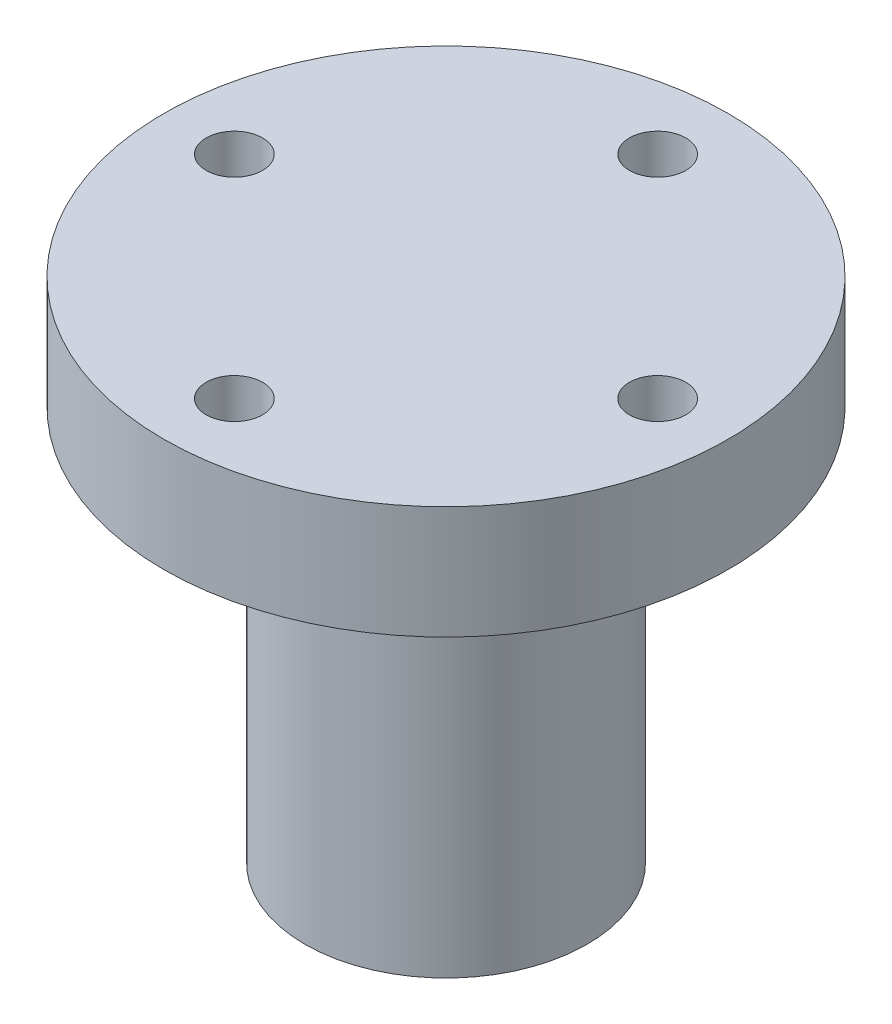
from build123d import *

# Parameters (mm, degrees)
CROQUIS1_R              = 25
SALIENTE_EXTRUIR1_DEPTH = 35
CROQUIS2_R              = 50
SALIENTE_EXTRUIR2_DEPTH = 20
CORTAR_EXTRUIR1_REACH   = 116.455
CROQUIS3_R              = 5


with BuildPart() as part:
    # Croquis1 → Saliente-Extruir1 (new, symmetric)
    with BuildSketch(Plane(origin=(0, 0, 0), x_dir=(1, 0, 0), z_dir=(0, 1, 0))):
        with Locations(Location((0, 0, 0), (0, 0, 270))):
            Circle(CROQUIS1_R)
    extrude(amount=SALIENTE_EXTRUIR1_DEPTH, both=True)

    # Croquis2 → Saliente-Extruir2 (add)
    with BuildSketch(Plane(origin=(0, 35, 0), x_dir=(1, 0, 0), z_dir=(0, 1, 0))):
        with Locations(Location((0, 0, 0), (0, 0, 270))):
            Circle(CROQUIS2_R)
    extrude(amount=SALIENTE_EXTRUIR2_DEPTH)

    # Croquis3 → Cortar-Extruir1 (cut, up to next)
    with BuildSketch(Plane(origin=(0, 55, 0), x_dir=(1, 0, 0), z_dir=(0, 1, 0)), mode=Mode.PRIVATE) as cortar_extruir1_sk1:
        with Locations(Location((0, 37.5, 0), (0, 0, 270))):
            Circle(CROQUIS3_R)
    cortar_extruir1_tool1 = extrude(cortar_extruir1_sk1.sketch, amount=-CORTAR_EXTRUIR1_REACH, mode=Mode.PRIVATE) & part.part
    # Croquis3 → Cortar-Extruir1 (cut, up to next)
    with BuildSketch(Plane(origin=(0, 55, 0), x_dir=(1, 0, 0), z_dir=(0, 1, 0)), mode=Mode.PRIVATE) as cortar_extruir1_sk2:
        with Locations(Location((37.5, 0, 0), (0, 0, 270))):
            Circle(CROQUIS3_R)
    cortar_extruir1_tool2 = extrude(cortar_extruir1_sk2.sketch, amount=-CORTAR_EXTRUIR1_REACH, mode=Mode.PRIVATE) & part.part
    # Croquis3 → Cortar-Extruir1 (cut, up to next)
    with BuildSketch(Plane(origin=(0, 55, 0), x_dir=(1, 0, 0), z_dir=(0, 1, 0)), mode=Mode.PRIVATE) as cortar_extruir1_sk3:
        with Locations(Location((0, -37.5, 0), (0, 0, 270))):
            Circle(CROQUIS3_R)
    cortar_extruir1_tool3 = extrude(cortar_extruir1_sk3.sketch, amount=-CORTAR_EXTRUIR1_REACH, mode=Mode.PRIVATE) & part.part
    # Croquis3 → Cortar-Extruir1 (cut, up to next)
    with BuildSketch(Plane(origin=(0, 55, 0), x_dir=(1, 0, 0), z_dir=(0, 1, 0)), mode=Mode.PRIVATE) as cortar_extruir1_sk4:
        with Locations(Location((-37.5, 0, 0), (0, 0, 270))):
            Circle(CROQUIS3_R)
    cortar_extruir1_tool4 = extrude(cortar_extruir1_sk4.sketch, amount=-CORTAR_EXTRUIR1_REACH, mode=Mode.PRIVATE) & part.part
    add(cortar_extruir1_tool1.solids().sort_by_distance((0, 55, -37.5))[0], mode=Mode.SUBTRACT)
    add(cortar_extruir1_tool2.solids().sort_by_distance((37.5, 55, 0))[0], mode=Mode.SUBTRACT)
    add(cortar_extruir1_tool3.solids().sort_by_distance((0, 55, 37.5))[0], mode=Mode.SUBTRACT)
    add(cortar_extruir1_tool4.solids().sort_by_distance((-37.5, 55, 0))[0], mode=Mode.SUBTRACT)


solid = part.part
